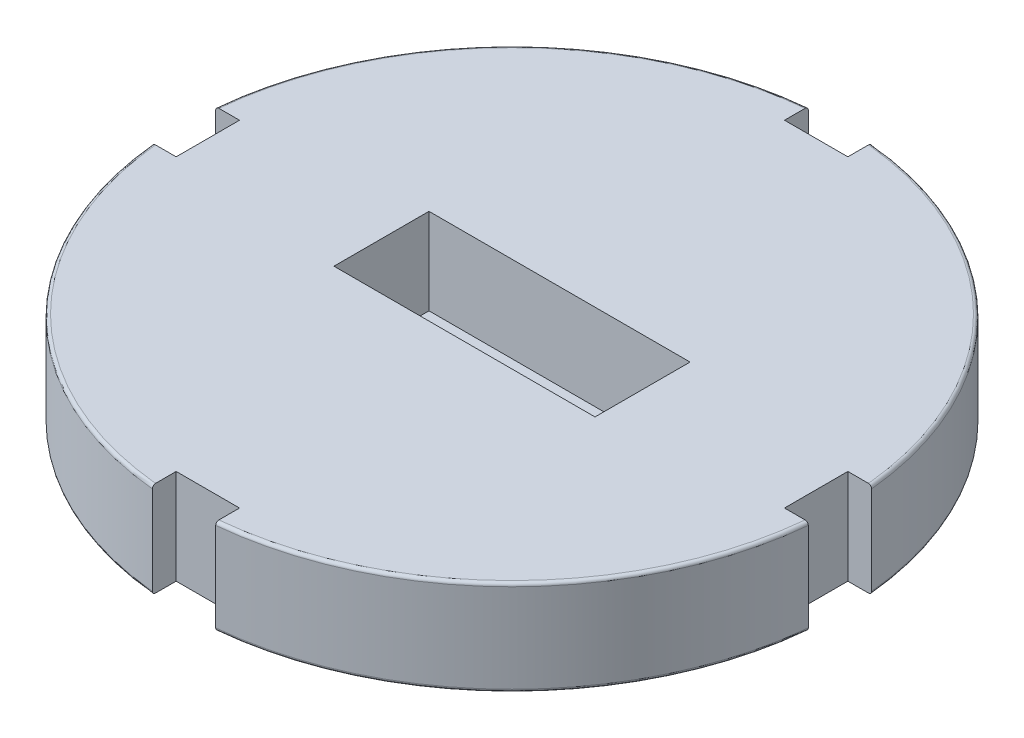
from build123d import *

# Parameters (mm, degrees)
SKETCH2_R           = 66.04
BOSS_EXTRUDE1_DEPTH = 19.05
FILLET1_R           = 0.635
SKETCH4_W           = 12.7
SKETCH4_H           = 9.0994385
SKETCH4_W_2         = 9.0994385
SKETCH4_H_2         = 12.7
CUT_EXTRUDE2_DEPTH  = 96.317709267
SKETCH5_W           = 52.324
SKETCH5_H           = 19.05
CUT_EXTRUDE3_DEPTH  = 17.272


with BuildPart() as part:
    # Sketch2 → Boss-Extrude1 (new body)
    with BuildSketch(Plane(origin=(0, 0, 0), x_dir=(1, 0, 0), z_dir=(0, 1, 0))):
        with Locations(Location((0, 0, 0), (0, 0, 90))):
            Circle(SKETCH2_R)
    extrude(amount=BOSS_EXTRUDE1_DEPTH)

    # Fillet1
    fillet1_edges = [part.edges().sort_by_distance(p)[0] for p in [
        (0, 0, 66.04),
        (0, 19.05, 66.04),
    ]]
    fillet(fillet1_edges, radius=FILLET1_R)

    # Sketch4 → Cut-Extrude2 (cut, through all)
    with BuildSketch(Plane.XZ):
        with Locations((0, -65.50971925)):
            Rectangle(SKETCH4_W, SKETCH4_H)
        with Locations((-65.50971925, 0)):
            Rectangle(SKETCH4_W_2, SKETCH4_H_2)
        with Locations((0, 65.50971925)):
            Rectangle(SKETCH4_W, SKETCH4_H)
        with Locations((65.50971925, 0)):
            Rectangle(SKETCH4_W_2, SKETCH4_H_2)
    extrude(amount=-CUT_EXTRUDE2_DEPTH, mode=Mode.SUBTRACT)

    # Sketch5 → Cut-Extrude3 (cut)
    with BuildSketch(Plane(origin=(0, 19.05, 0), x_dir=(1, 0, 0), z_dir=(0, 1, 0))):
        Rectangle(SKETCH5_W, SKETCH5_H)
    extrude(amount=-CUT_EXTRUDE3_DEPTH, mode=Mode.SUBTRACT)


solid = part.part
